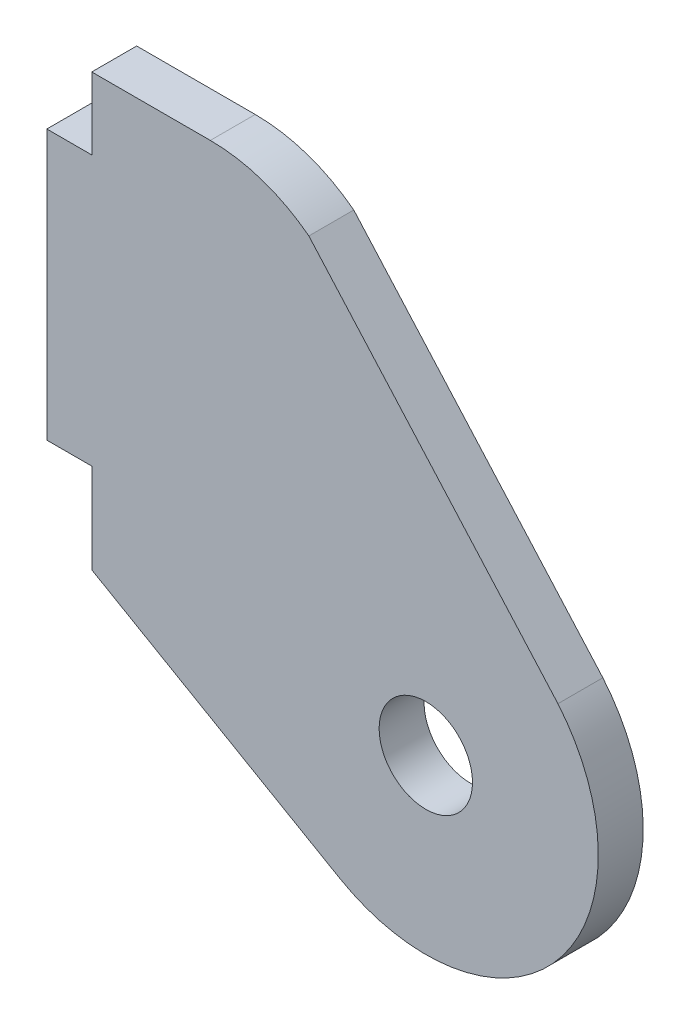
from build123d import *

# Parameters (mm, degrees)
BOSS_EXTRUDE1_DEPTH      = 3.175
M6_CLEARANCE_HOLE1_D     = 6.6
M6_CLEARANCE_HOLE1_DEPTH = 3.302
M6_CLEARANCE_HOLE1_TIP   = 1.982840043


with BuildPart() as part:
    # Sketch1 → Boss-Extrude1 (new body)
    with BuildSketch(Plane.XY):
        with BuildLine():
            Line((-79.409543338, -48.870574021), (-79.409543338, -29.820574021))
            Line((-79.409543338, -29.820574021), (-76.234543338, -29.820574021))
            Line((-76.234543338, -29.820574021), (-76.234543338, -24.740574021))
            Line((-76.234543338, -24.740574021), (-67.852543338, -24.740574021))
            ThreePointArc((-67.852543338, -24.740574021), (-64.175656813, -25.348124877), (-60.889653149, -27.10618986))
            Line((-60.889653149, -27.10618986), (-43.281292183, -46.938938374))
            ThreePointArc((-43.281292183, -46.938938374), (-43.281292183, -62.612671449), (-58.716906034, -65.334386634))
            Line((-58.716906034, -65.334386634), (-76.234543338, -55.220574021))
            Line((-76.234543338, -55.220574021), (-76.234543338, -48.870574021))
            Line((-76.234543338, -48.870574021), (-79.409543338, -48.870574021))
        make_face()
    extrude(amount=BOSS_EXTRUDE1_DEPTH)

    # M6 Clearance Hole1
    with Locations(Plane(origin=(0, 0, 0), x_dir=(-1, 0, 0), z_dir=(0, 0, -1))):
        with Locations((52.620906034, -54.775804912)):
            Hole(M6_CLEARANCE_HOLE1_D / 2, depth=M6_CLEARANCE_HOLE1_DEPTH)
            with Locations((0, 0, -(M6_CLEARANCE_HOLE1_DEPTH + M6_CLEARANCE_HOLE1_TIP / 2))):  # 118° drill point
                Cone(0, M6_CLEARANCE_HOLE1_D / 2, M6_CLEARANCE_HOLE1_TIP, mode=Mode.SUBTRACT)


solid = part.part
